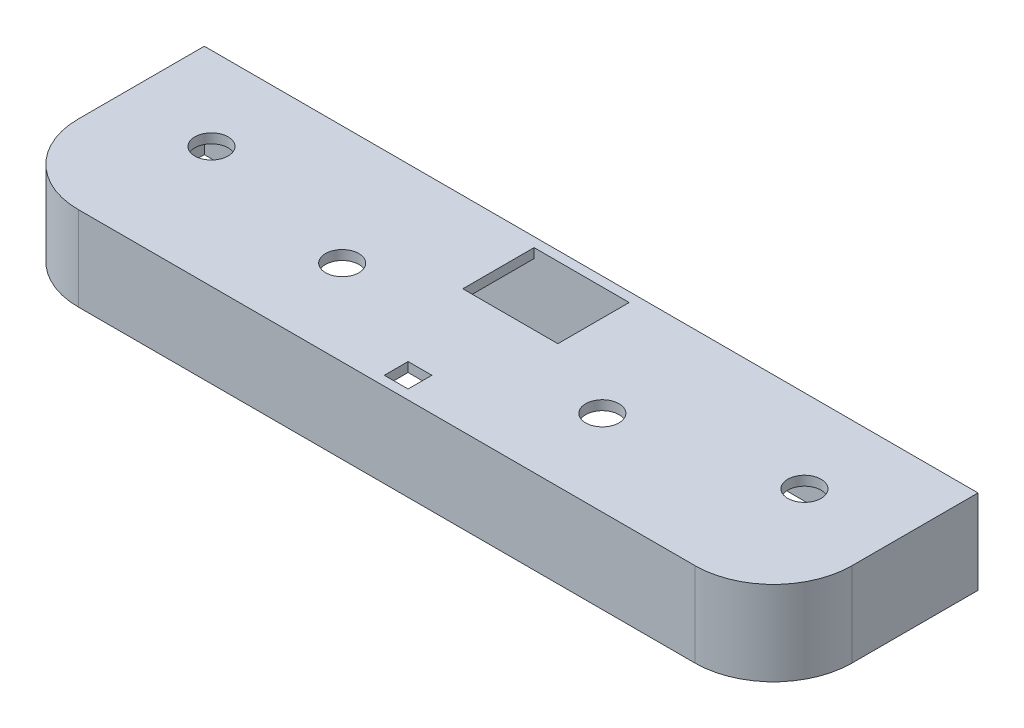
from build123d import *

# Parameters (mm, degrees)
SKETCH1_W           = 162.7
SKETCH1_H           = 43
BOSS_EXTRUDE2_DEPTH = 17.75
FILLET2_R           = 16.5
SHELL1_T            = -2
SKETCH2_R           = 3.5
CUT_EXTRUDE1_DEPTH  = 86.994970783
SKETCH5_W           = 20
SKETCH5_H           = 15
CUT_EXTRUDE2_DEPTH  = 86.994970783
SKETCH6_W           = 5
SKETCH6_H           = 5
CUT_EXTRUDE3_DEPTH  = 86.994970783


with BuildPart() as part:
    # Sketch1 → Boss-Extrude2 (new body)
    with BuildSketch(Plane(origin=(0, 0, 0), x_dir=(1, 0, 0), z_dir=(0, 1, 0))):
        Rectangle(SKETCH1_W, SKETCH1_H)
    extrude(amount=BOSS_EXTRUDE2_DEPTH)

    # Fillet2
    fillet2_edges = [part.edges().sort_by_distance(p)[0] for p in [
        (81.35, 8.875, 21.5),
        (-81.35, 8.875, 21.5),
    ]]
    fillet(fillet2_edges, radius=FILLET2_R)

    # Shell1
    shell1_openings = [part.faces().sort_by_distance(p)[0] for p in [
        (0, 0, -0.302595299),
    ]]
    offset(amount=SHELL1_T, openings=shell1_openings, kind=Kind.INTERSECTION)

    # Sketch2 → Cut-Extrude1 (cut, through all)
    with BuildSketch(Plane(origin=(0, 17.75, 0), x_dir=(1, 0, 0), z_dir=(0, 1, 0))):
        with Locations(Location((-62.35, 4, 0), (0, 0, 270))):
            Circle(SKETCH2_R)
        with Locations(Location((-27.35, -3.5, 0), (0, 0, 270))):
            Circle(SKETCH2_R)
        with Locations(Location((27.35, -3.5, 0), (0, 0, 90))):
            Circle(SKETCH2_R)
        with Locations(Location((62.35, 4, 0), (0, 0, 90))):
            Circle(SKETCH2_R)
    extrude(amount=-CUT_EXTRUDE1_DEPTH, mode=Mode.SUBTRACT)

    # Sketch5 → Cut-Extrude2 (cut, through all)
    with BuildSketch(Plane(origin=(0, 17.75, 0), x_dir=(1, 0, 0), z_dir=(0, 1, 0))):
        with Locations((0, 12)):
            Rectangle(SKETCH5_W, SKETCH5_H)
    extrude(amount=-CUT_EXTRUDE2_DEPTH, mode=Mode.SUBTRACT)

    # Sketch6 → Cut-Extrude3 (cut, through all)
    with BuildSketch(Plane(origin=(0, 17.75, 0), x_dir=(1, 0, 0), z_dir=(0, 1, 0))):
        with Locations((0, -17)):
            Rectangle(SKETCH6_W, SKETCH6_H)
    extrude(amount=-CUT_EXTRUDE3_DEPTH, mode=Mode.SUBTRACT)


solid = part.part
